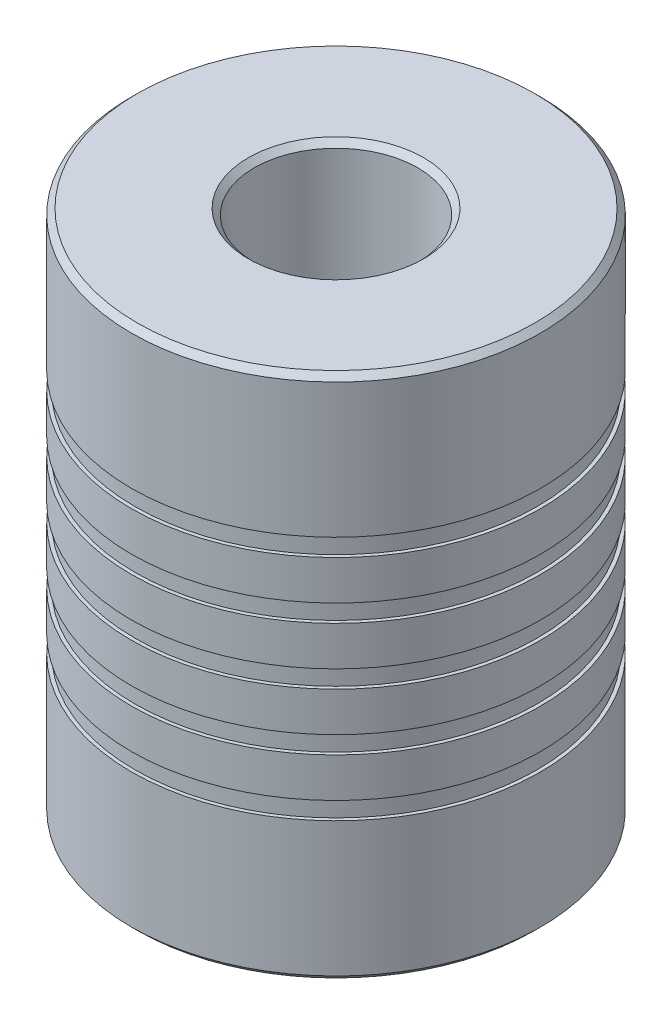
from build123d import *

# Parameters (mm, degrees)
CHAMFER_1_SIZE = 0.5


with BuildPart() as part:
    # Эскиз1 → Повернуть1 (revolve)
    with BuildSketch(Plane.XY):
        Polygon((7, 22.5), (17.5, 22.5), (17.5, 10.5), (17.2, 10.5), (17.2, 9), (17.5, 9), (17.5, 5.625), (17.2, 5.625), (17.2, 4.125), (17.5, 4.125), (17.5, 0.75), (17.2, 0.75), (17.2, -0.75), (17.5, -0.75), (17.5, -4.125), (17.2, -4.125), (17.2, -5.625), (17.5, -5.625), (17.5, -9), (17.2, -9), (17.2, -10.5), (17.5, -10.5), (17.5, -22.5), (7, -22.5), align=None)
    revolve(axis=Axis((0, 53.65103478, 0), (0, -1, 0)))

    # Фаска1
    chamfer_1_edges = [part.edges().sort_by_distance(p)[0] for p in [
        (-7, -22.5, 0),
        (-17.5, -22.5, 0),
        (-7, 22.5, 0),
        (-17.5, 22.5, 0),
    ]]
    chamfer(chamfer_1_edges, length=CHAMFER_1_SIZE)


solid = part.part
